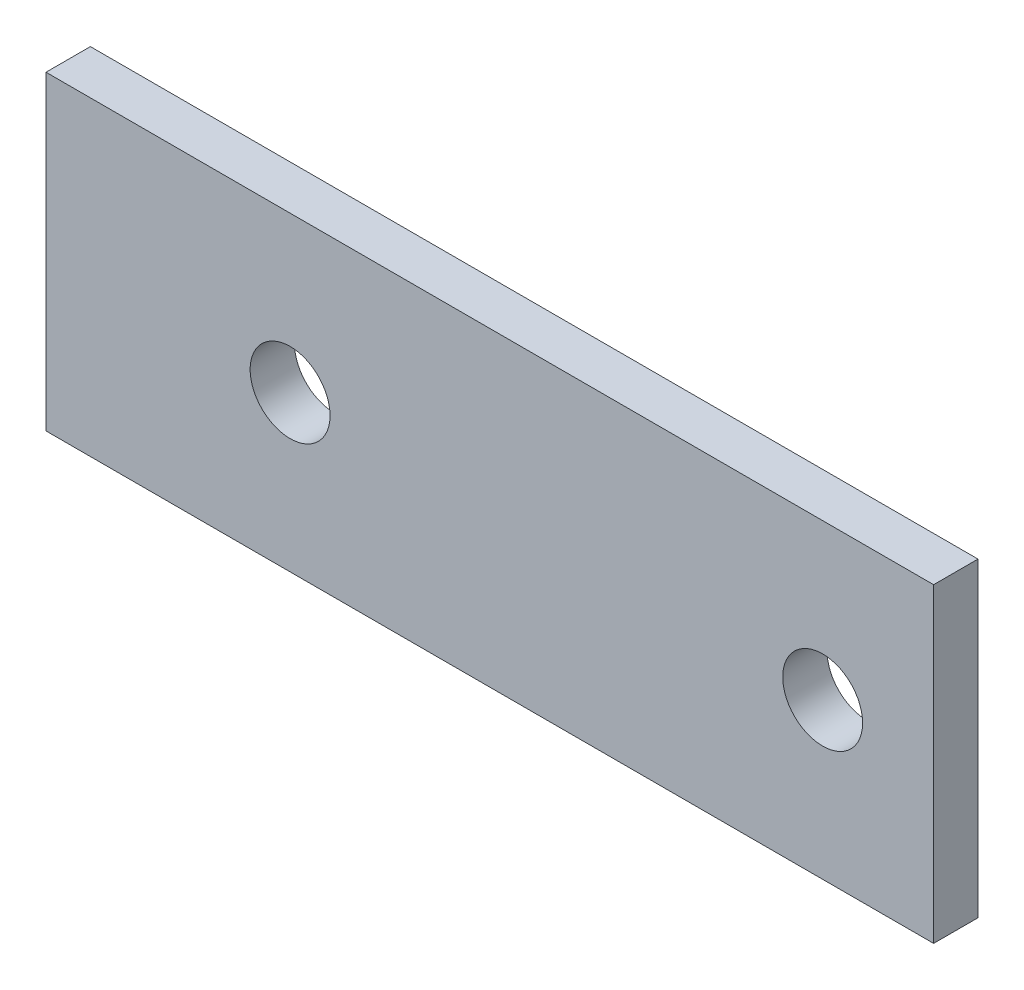
from build123d import *

# Parameters (mm, degrees)
SKETCH1_W           = 200
SKETCH1_H           = 70
SKETCH1_R           = 9
BOSS_EXTRUDE1_DEPTH = 5


with BuildPart() as part:
    # Sketch1 → Boss-Extrude1 (new, symmetric)
    with BuildSketch(Plane.XY):
        Rectangle(SKETCH1_W, SKETCH1_H)
        with Locations((75, 0)):
            Circle(SKETCH1_R, mode=Mode.SUBTRACT)
        with Locations((-45, 0)):
            Circle(SKETCH1_R, mode=Mode.SUBTRACT)
    extrude(amount=BOSS_EXTRUDE1_DEPTH, both=True)


solid = part.part
